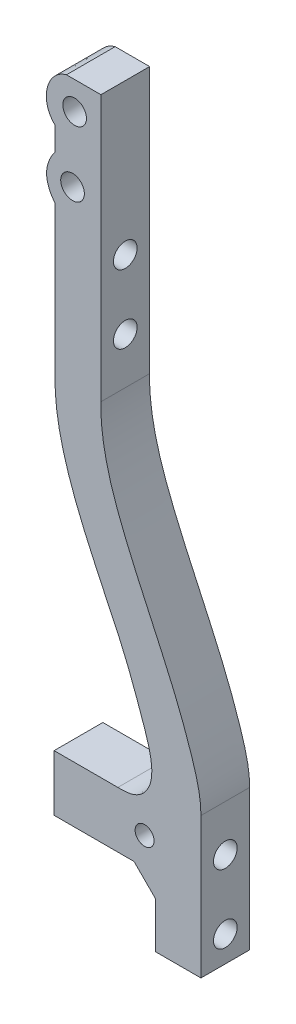
from build123d import *

# Parameters (mm, degrees)
SCHIZZO1_R                   = 1
ESTRUSIONE_ESTRUSIONE1_DEPTH = 5.15
FORO_FILETTATO_M3X0_5_1_D    = 2.5
FORO_FILETTATO_M3X0_5_2_D    = 2.5


with BuildPart() as part:
    # Schizzo1 → Estrusione-Estrusione1 (new body)
    with BuildSketch(Plane.XY):
        with BuildLine():
            Line((5.774092887, 81.005050638), (9.420451412, 81.005050638))
            Line((9.420451412, 81.005050638), (9.420451412, 52.896037581))
            add(Edge.make_bspline(
                [(19.993180208, 20.304049613), (20.000392243, 21.937597291), (19.136290328, 25.09540445), (17.251117362, 30.199917591), (14.840967319, 35.376814158), (11.407074739, 42.841952294), (9.321298994, 48.642190699), (9.420451412, 52.896037581)],
                knots=[0, 0, 0, 0, 0.139682766, 0.283827316, 0.472965528, 0.635702962, 1, 1, 1, 1], degree=3))
            Line((19.993180208, 20.304049613), (19.993180208, 5.431477505))
            Line((19.993180208, 5.431477505), (15.180154721, 5.431477505))
            Line((15.180154721, 5.431477505), (15.180154721, 10.299047849))
            Line((15.180154721, 10.299047849), (12.918006965, 12.561195605))
            Line((12.918006965, 12.561195605), (4.47403255, 12.561195605))
            Line((4.47403255, 12.561195605), (4.47403255, 18.486652797))
            Line((4.47403255, 18.486652797), (11.20904805, 18.486652797))
            add(Edge.make_bspline(
                [(4.570340235, 52.896037581), (4.500981426, 49.543554951), (5.932867071, 43.955021228), (9.218772599, 36.723990517), (11.987968496, 31.114139773), (13.652178303, 26.417541941), (14.789252198, 23.160638336), (14.87184014, 20.739192121), (13.998789651, 19.218561632), (12.677613677, 18.480234626), (11.705324935, 18.486652797), (11.20904805, 18.486652797)],
                knots=[0, 0, 0, 0, 0.25872816, 0.443278346, 0.618370517, 0.745139829, 0.830875407, 0.886814382, 0.927349507, 0.960443227, 1, 1, 1, 1], degree=3))
            Line((4.570340235, 52.896037581), (4.570340235, 68.659015754))
            add(Edge.make_bspline(
                [(4.570340235, 68.659015754), (4.043420457, 69.286724479), (3.296904659, 70.986958522), (4.068519262, 72.668133187), (4.570340235, 73.338444315)],
                knots=[0, 0, 0, 0, 0.492973619, 1, 1, 1, 1], degree=3))
            Line((4.570340235, 73.338444315), (4.570340235, 75.802736339))
            add(Edge.make_bspline(
                [(5.774092887, 81.005050638), (3.638095606, 80.427239868), (2.887343432, 77.378785907), (4.570340235, 75.802736339)],
                knots=[0, 0, 0, 0, 1, 1, 1, 1], degree=3))
        make_face()
        with Locations(Location((14.035609494, 15.5002807, 0), (0, 0, 180))):
            Circle(SCHIZZO1_R, mode=Mode.SUBTRACT)
    extrude(amount=ESTRUSIONE_ESTRUSIONE1_DEPTH)

    # Foro filettato M3x0.5-1 (through all)
    with Locations(Plane.XY.offset(5.15)):
        with Locations((6.642606901, 78.059235381), (6.420451412, 71.059235381)):
            Hole(FORO_FILETTATO_M3X0_5_1_D / 2)

    # Foro filettato M3x0.5-2 (through all)
    with Locations(Plane(origin=(19.993180208, 0, 0), x_dir=(0, 0, -1), z_dir=(1, 0, 0))):
        with Locations((-2.575, 65.065050638), (-2.575, 57.805050638), (-2.575, 15.431477505), (-2.575, 8.171477505)):
            Hole(FORO_FILETTATO_M3X0_5_2_D / 2)


solid = part.part
